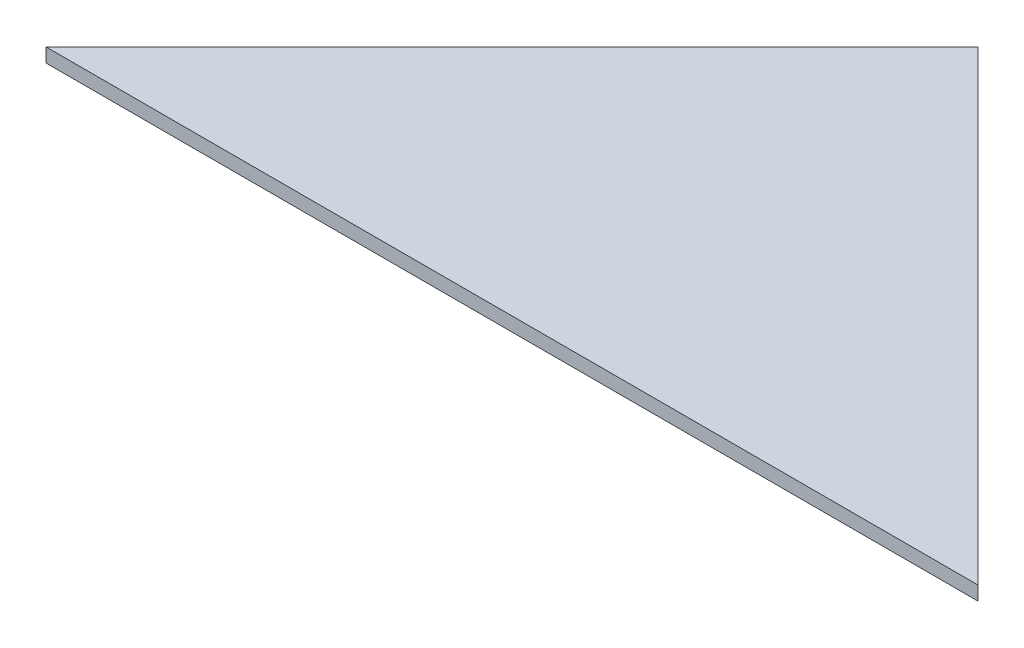
from build123d import *

# Parameters (mm, degrees)
BOSS_EXTRUDE1_DEPTH = 1.5


with BuildPart() as part:
    # Sketch1 → Boss-Extrude1 (new body)
    with BuildSketch(Plane(origin=(0, 0, 0), x_dir=(1, 0, 0), z_dir=(0, 1, 0))):
        Polygon((0, 0), (-50, -50), (50, -50), align=None)
    extrude(amount=BOSS_EXTRUDE1_DEPTH)


solid = part.part
